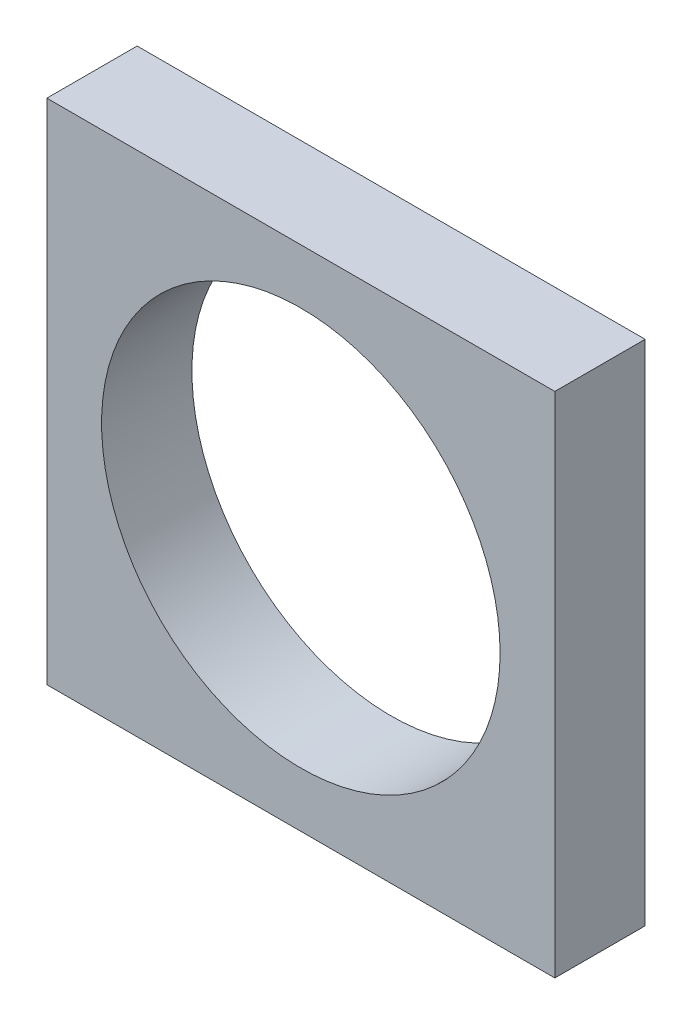
from build123d import *

# Parameters (mm, degrees)
SKETCH1_W           = 45
SKETCH1_H           = 45
SKETCH1_R           = 17.65
BOSS_EXTRUDE1_DEPTH = 8


with BuildPart() as part:
    # Sketch1 → Boss-Extrude1 (new body)
    with BuildSketch(Plane.XY):
        Rectangle(SKETCH1_W, SKETCH1_H)
        Circle(SKETCH1_R, mode=Mode.SUBTRACT)
    extrude(amount=BOSS_EXTRUDE1_DEPTH)


solid = part.part
